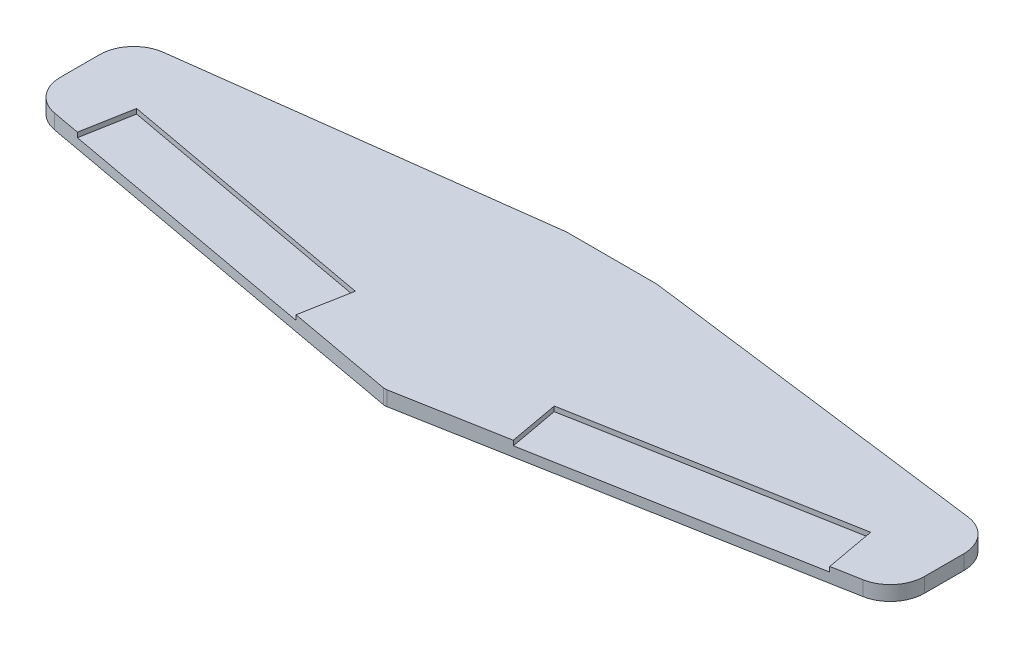
from build123d import *

# Parameters (mm, degrees)
BOSS_EXTRUDE1_DEPTH = 3
FILLET2_R           = 2
CUT_EXTRUDE1_DEPTH  = 1


with BuildPart() as part:
    # Sketch1 → Boss-Extrude1 (new body)
    with BuildSketch(Plane(origin=(0, 0, 0), x_dir=(1, 0, 0), z_dir=(0, 1, 0))):
        with BuildLine():
            Line((9.261243058, 19.135372648), (-9.261243058, 19.135372648))
            Line((-9.261243058, 19.135372648), (-82.394201363, 9.715975022))
            ThreePointArc((-82.394201363, 9.715975022), (-86.756396558, 7.396125613), (-88.5, 2.773323949))
            Line((-88.5, 2.773323949), (-88.5, -5.301071921))
            ThreePointArc((-88.5, -5.301071921), (-86.876170995, -9.784015756), (-82.758061306, -12.187092669))
            Line((-82.758061306, -12.187092669), (0, -27.306813988))
            Line((0, -27.306813988), (82.758061306, -12.187092669))
            ThreePointArc((82.758061306, -12.187092669), (86.876170995, -9.784015756), (88.5, -5.301071921))
            Line((88.5, -5.301071921), (88.5, 2.773323949))
            ThreePointArc((88.5, 2.773323949), (86.756396558, 7.396125613), (82.394201363, 9.715975022))
            Line((82.394201363, 9.715975022), (9.261243058, 19.135372648))
        make_face()
    extrude(amount=BOSS_EXTRUDE1_DEPTH)

    # Fillet2
    fillet2_edges = [part.edges().sort_by_distance(p)[0] for p in [
        (0, 1.5, 27.306813988),
    ]]
    fillet(fillet2_edges, radius=FILLET2_R)

    # Sketch2 → Cut-Extrude1 (cut)
    with BuildSketch(Plane(origin=(0, 3, 0), x_dir=(1, 0, 0), z_dir=(0, 1, 0))):
        Polygon((-77.031853449, -13.233258633), (-75.158975168, -2.982026326), (-20.368957027, -12.9920458), (-22.241835309, -23.243278108), align=None)
        Polygon((20.368957027, -12.9920458), (22.241835309, -23.243278108), (77.031853449, -13.233258633), (75.158975168, -2.982026326), align=None)
    extrude(amount=-CUT_EXTRUDE1_DEPTH, mode=Mode.SUBTRACT)


solid = part.part
